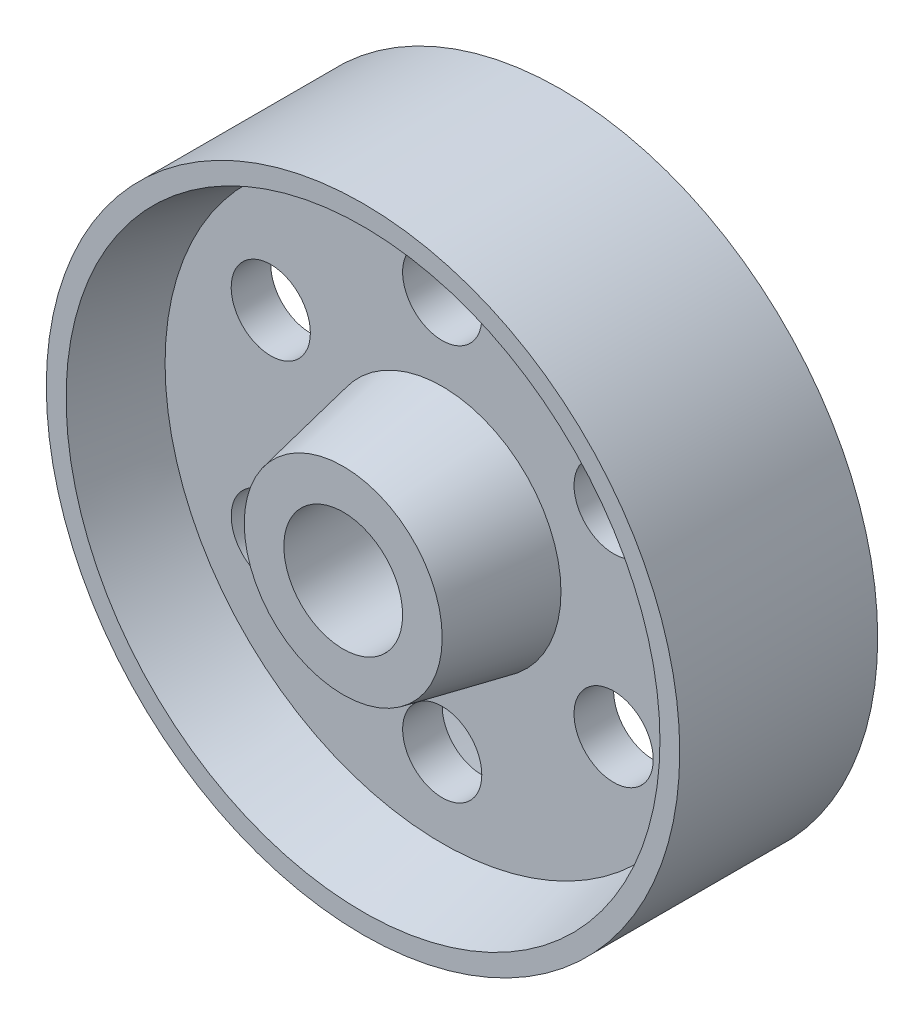
from build123d import *

# Parameters (mm, degrees)
SKETCH2_R          = 6.35
CUT_EXTRUDE1_DEPTH = 76.201267443
CIRPATTERN1_COUNT  = 6


with BuildPart() as part:
    # Sketch1 → Revolve1 (revolve)
    with BuildSketch(Plane(origin=(0, 0, 0), x_dir=(0, 0, -1), z_dir=(1, 0, 0)), mode=Mode.PRIVATE) as revolve1_sk:
        Polygon((19.05, 9.525), (-19.05, 9.525), (-19.05, 15.875), (-3.175, 19.05), (-3.175, 44.45), (-15.875, 47.625), (-15.875, 50.8), (15.875, 50.8), (15.875, 47.625), (3.175, 44.45), (3.175, 19.05), (19.05, 15.875), align=None)
    revolve(revolve1_sk.sketch.rotate(Axis((0, 0, 37.30886104), (0, 0, -1)), 90), axis=Axis((0, 0, 37.30886104), (0, 0, -1)))

    # Sketch2 → Cut-Extrude1 (cut, through all)
    with BuildSketch(Plane.XY.offset(3.175)):
        with Locations((0, 31.75)):
            Circle(SKETCH2_R)
    cut_extrude1 = extrude(amount=-CUT_EXTRUDE1_DEPTH, mode=Mode.SUBTRACT)

    # CirPattern1: Cut-Extrude1 ×6 about axis
    cirpattern1_axis = Axis((0, 0, 0), (0, 0, 1))
    for i in range(1, CIRPATTERN1_COUNT):
        add(cut_extrude1.rotate(cirpattern1_axis, i * 360 / CIRPATTERN1_COUNT), mode=Mode.SUBTRACT)


solid = part.part
